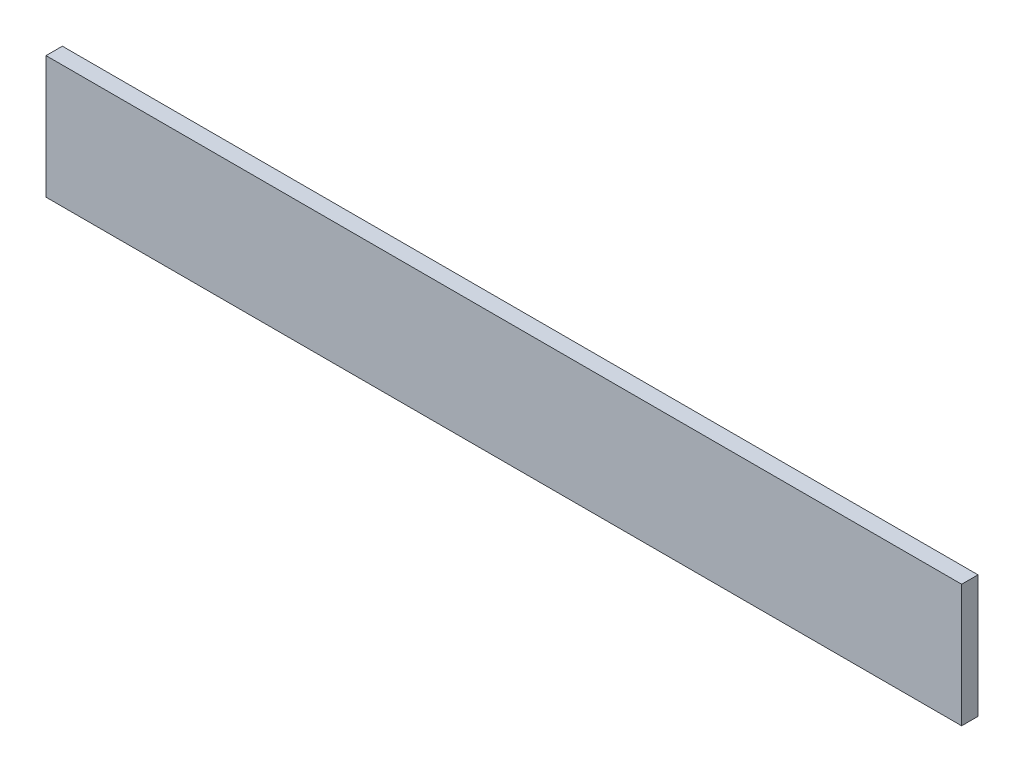
from build123d import *

# Parameters (mm, degrees)
SKIZZE1_W                       = 112
SKIZZE1_H                       = 15
AUFSATZ_LINEAR_AUSTRAGEN1_DEPTH = 2


with BuildPart() as part:
    # Skizze1 → Aufsatz-Linear austragen1 (new body)
    with BuildSketch(Plane(origin=(0, 0, 0), x_dir=(-1, 0, 0), z_dir=(0, 0, 1))):
        with Locations((56, 7.5)):
            Rectangle(SKIZZE1_W, SKIZZE1_H)
    extrude(amount=AUFSATZ_LINEAR_AUSTRAGEN1_DEPTH)


solid = part.part
